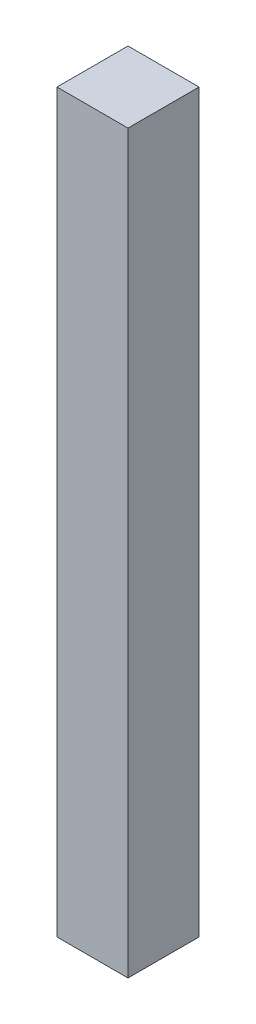
from build123d import *

# Parameters (mm, degrees)
CROQUIS_PATA_W       = 70
CROQUIS_PATA_H       = 70
PATA_70X70X725_DEPTH = 725


with BuildPart() as part:
    # Croquis_pata → Pata_70x70x725 (new body)
    with BuildSketch(Plane(origin=(0, 0, 0), x_dir=(1, 0, 0), z_dir=(0, 1, 0))):
        Rectangle(CROQUIS_PATA_W, CROQUIS_PATA_H)
    extrude(amount=PATA_70X70X725_DEPTH)


solid = part.part
